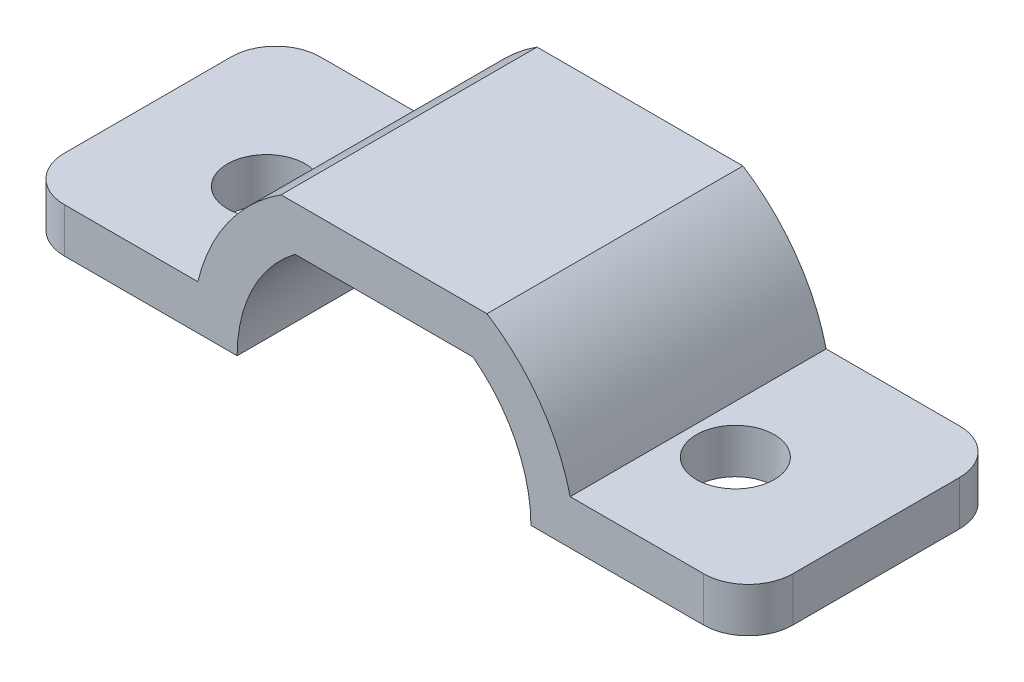
from build123d import *

# Parameters (mm, degrees)
BOSS_EXTRUDE1_DEPTH   = 5.75
BOSS_EXTRUDE1_2_DEPTH = 5.75
BOSS_EXTRUDE2_DEPTH   = 5.75
SKETCH3_R             = 1.75
CUT_EXTRUDE2_DEPTH    = 19.122150851
FILLET1_R             = 2


with BuildPart() as part:
    # Sketch2 → Boss-Extrude1 (new, symmetric)
    with BuildSketch(Plane.XY):
        with BuildLine():
            Line((-16.364209467, 0), (-8.6, 0))
            ThreePointArc((-8.6, 0), (-8.540848945, 1.006925665), (-8.364209467, 2))
            Line((-8.364209467, 2), (-16.364209467, 2))
            Line((-16.364209467, 2), (-16.364209467, 0))
        make_face()
    extrude(amount=BOSS_EXTRUDE1_DEPTH, both=True)



with BuildPart() as body_2:
    # Sketch2 → Boss-Extrude1 2 (new, symmetric)
    with BuildSketch(Plane.XY):
        with BuildLine():
            ThreePointArc((8.364209467, 2), (8.540848945, 1.006925665), (8.6, 0))
            Line((8.6, 0), (16.364209467, 0))
            Line((16.364209467, 0), (16.364209467, 2))
            Line((16.364209467, 2), (8.364209467, 2))
        make_face()
    extrude(amount=BOSS_EXTRUDE1_2_DEPTH, both=True)


with BuildPart() as part_1:
    add(part.part)

    add(body_2.part)  # Boss-Extrude2 merges body 2
    # Sketch2<4> → Boss-Extrude2 (add, symmetric)
    with BuildSketch(Plane.XY):
        with BuildLine():
            Line((-8.6, 0), (-6.6, 0))
            ThreePointArc((-6.6, 0), (-5.914302048, 2.929339736), (-3.999687488, 5.25))
            Line((-3.999687488, 5.25), (3.999687488, 5.25))
            ThreePointArc((3.999687488, 5.25), (5.914302048, 2.929339736), (6.6, 0))
            Line((6.6, 0), (8.6, 0))
            ThreePointArc((8.6, 0), (8.540848945, 1.006925665), (8.364209467, 2))
            ThreePointArc((8.364209467, 2), (7.005379537, 4.988452419), (4.625743184, 7.25))
            Line((4.625743184, 7.25), (-4.625743184, 7.25))
            ThreePointArc((-4.625743184, 7.25), (-7.005379537, 4.988452419), (-8.364209467, 2))
            ThreePointArc((-8.364209467, 2), (-8.540848945, 1.006925665), (-8.6, 0))
        make_face()
    extrude(amount=BOSS_EXTRUDE2_DEPTH, both=True)

    # Sketch3 → Cut-Extrude2 (cut, through all)
    with BuildSketch(Plane(origin=(0, 2, 0), x_dir=(1, 0, 0), z_dir=(0, 1, 0))):
        with Locations((-10.535, -0.5)):
            Circle(SKETCH3_R)
    cut_extrude2 = extrude(amount=-CUT_EXTRUDE2_DEPTH, mode=Mode.SUBTRACT)

    # Mirror1: Cut-Extrude2 across plane
    add(cut_extrude2.mirror(Plane(origin=(0, 0, 0), x_dir=(0, 0, 1), z_dir=(1, 0, 0))), mode=Mode.SUBTRACT)

    # Fillet1
    fillet1_edges = [part_1.edges().sort_by_distance(p)[0] for p in [
        (-16.364209467, 1, 5.75),
        (-16.364209467, 1, -5.75),
        (16.364209467, 1, -5.75),
        (16.364209467, 1, 5.75),
    ]]
    fillet(fillet1_edges, radius=FILLET1_R)


solid = part_1.part
